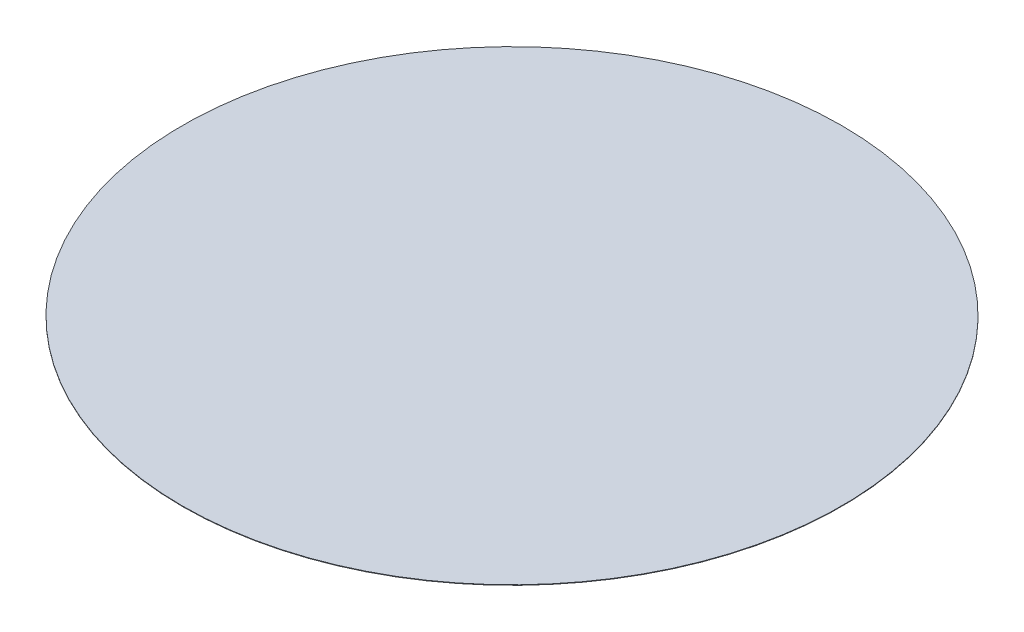
from build123d import *

# Parameters (mm, degrees)
SKETCH1_R           = 2750
BOSS_EXTRUDE1_DEPTH = 4


with BuildPart() as part:
    # Sketch1 → Boss-Extrude1 (new body)
    with BuildSketch(Plane(origin=(0, 0, 0), x_dir=(1, 0, 0), z_dir=(0, 1, 0))):
        with Locations(Location((0, 0, 0), (0, 0, 270))):
            Circle(SKETCH1_R)
    extrude(amount=-BOSS_EXTRUDE1_DEPTH)


solid = part.part
